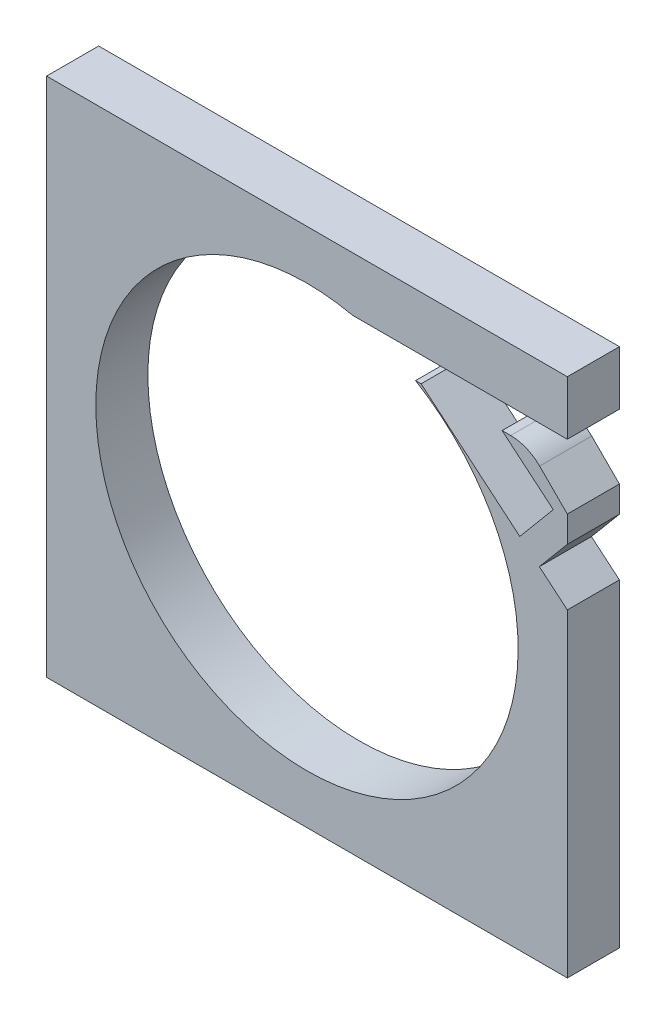
from build123d import *

# Parameters (mm, degrees)
SKETCH1_W           = 127
SKETCH1_H           = 127
BOSS_EXTRUDE1_DEPTH = 12.7
CUT_EXTRUDE1_REACH  = 92.696
SKETCH2_R           = 51.5
CUT_EXTRUDE2_REACH  = 92.696
CUT_EXTRUDE3_REACH  = 92.696
CUT_EXTRUDE4_DEPTH  = 91.696141042
FILLET1_R           = 10


with BuildPart() as part:
    # Sketch1 → Boss-Extrude1 (new body)
    with BuildSketch(Plane.XY):
        Rectangle(SKETCH1_W, SKETCH1_H)
    extrude(amount=BOSS_EXTRUDE1_DEPTH)

    # Sketch2 → Cut-Extrude1 (cut, up to next)
    with BuildSketch(Plane.XY.offset(12.7), mode=Mode.PRIVATE) as cut_extrude1_sk1:
        Circle(SKETCH2_R)
    cut_extrude1_tool1 = extrude(cut_extrude1_sk1.sketch, amount=-CUT_EXTRUDE1_REACH, mode=Mode.PRIVATE) & part.part
    add(cut_extrude1_tool1.solids().sort_by_distance((0, 0, 12.7))[0], mode=Mode.SUBTRACT)

    # Sketch3 → Cut-Extrude2 (cut, up to next)
    with BuildSketch(Plane.XY.offset(12.7), mode=Mode.PRIVATE) as cut_extrude2_sk1:
        Polygon((0, 50.285247175), (63.5, 50.285247175), (63.5, 34.489292445), (48.70404527, 49.285247175), (0, 49.285247175), align=None)
    cut_extrude2_tool1 = extrude(cut_extrude2_sk1.sketch, amount=-CUT_EXTRUDE2_REACH, mode=Mode.PRIVATE) & part.part
    add(cut_extrude2_tool1.solids().sort_by_distance((31.75, 49.630895, 12.7))[0], mode=Mode.SUBTRACT)

    # Sketch4 → Cut-Extrude3 (cut, up to next)
    with BuildSketch(Plane.XY.offset(12.7), mode=Mode.PRIVATE) as cut_extrude3_sk1:
        Polygon((41.495660788, 49.285247175), (60.075181823, 33.695177927), (51.91177918, 23.9664135), (21.737968187, 49.285247175), align=None)
    cut_extrude3_tool1 = extrude(cut_extrude3_sk1.sketch, amount=-CUT_EXTRUDE3_REACH, mode=Mode.PRIVATE) & part.part
    # Sketch4 → Cut-Extrude3 (cut, up to next)
    with BuildSketch(Plane.XY.offset(12.7), mode=Mode.PRIVATE) as cut_extrude3_sk2:
        Polygon((56.676941472, 19.967967578), (63.5, 28.099372092), (63.5, 14.242741684), align=None)
    cut_extrude3_tool2 = extrude(cut_extrude3_sk2.sketch, amount=-CUT_EXTRUDE3_REACH, mode=Mode.PRIVATE) & part.part
    add(cut_extrude3_tool1.solids().sort_by_distance((43.251809, 38.865217, 12.7))[0], mode=Mode.SUBTRACT)
    add(cut_extrude3_tool2.solids().sort_by_distance((61.225647, 20.770027, 12.7))[0], mode=Mode.SUBTRACT)

    # Sketch5 → Cut-Extrude4 (cut, through all)
    with BuildSketch(Plane.XY.offset(12.7)):
        Polygon((11.794347458, 49.797355322), (57.138646711, 49.797355322), (57.138646711, 44.171093993), (19.361103765, 44.171093993), align=None)
    extrude(amount=-CUT_EXTRUDE4_DEPTH, mode=Mode.SUBTRACT)

    # Fillet1
    fillet1_edges = [part.edges().sort_by_distance(p)[0] for p in [
        (53.818198452, 44.171093993, 6.35),
    ]]
    fillet(fillet1_edges, radius=FILLET1_R)


solid = part.part
